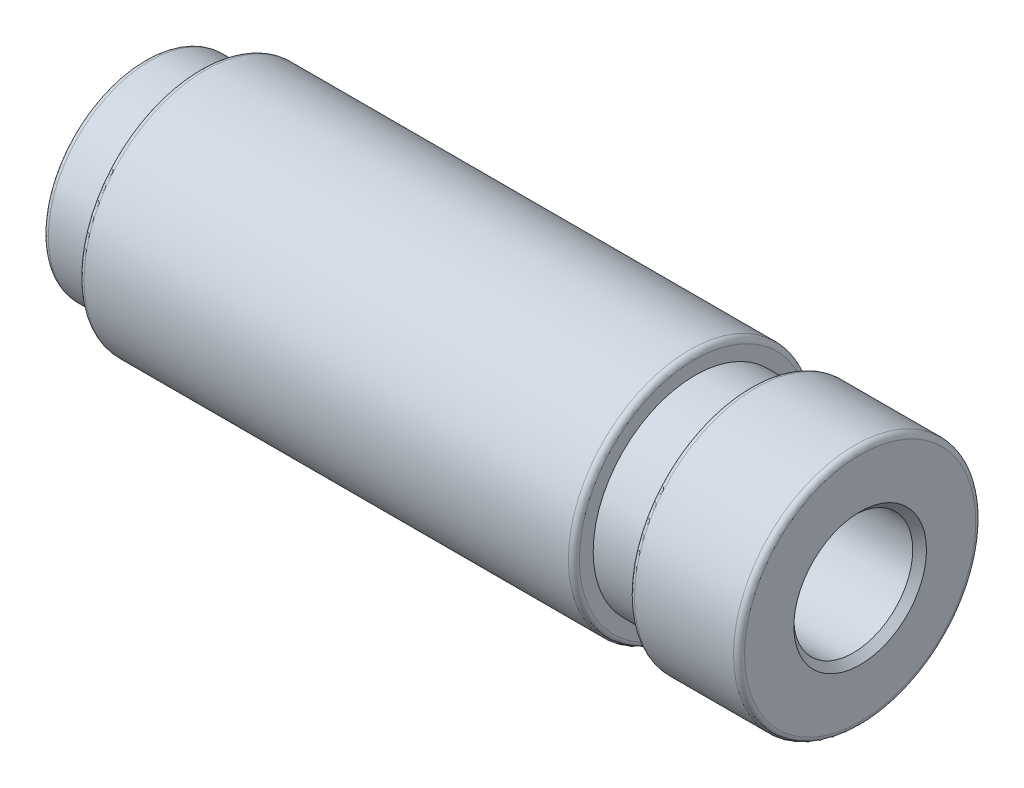
from build123d import *

# Parameters (mm, degrees)
ESBO_O2_R                             = 4.8
CORTE_EXTRUS_O1_DEPTH                 = 33
FURO_ROSCADO_DE_M12X1_251_D           = 10.8
FURO_ROSCADO_DE_M12X1_251_DEPTH       = 32
FURO_ROSCADO_DE_M12X1_251_CSINK_D     = 12.05
FURO_ROSCADO_DE_M12X1_251_CSINK_ANGLE = 90
FURO_ROSCADO_DE_M12X1_251_TIP         = 3.244647343
FILETE1_R                             = 1.5
FILETE2_R                             = 0.5
FILETE3_R                             = 0.5
FILETE4_R                             = 0.5


with BuildPart() as part:
    # Esboço1 → Revolução1 (revolve)
    with BuildSketch(Plane.XY, mode=Mode.PRIVATE) as revolu_o1_sk:
        Polygon((0, 0), (65, 0), (65, 11), (55, 11), (55, 9.25), (50, 9.25), (50, 11), (5, 11), (5, 9.25), (0, 9.25), align=None)
    revolve(revolu_o1_sk.sketch.rotate(Axis((0, 0, 0), (1, 0, 0)), 90), axis=Axis((0, 0, 0), (1, 0, 0)))

    # Esboço2 → Corte-extrusão1 (cut)
    with BuildSketch(Plane.ZY):
        Circle(ESBO_O2_R)
    extrude(amount=-CORTE_EXTRUS_O1_DEPTH, mode=Mode.SUBTRACT)

    # Furo roscado de M12x1.251
    with Locations(Plane(origin=(65, 0, 0), x_dir=(0, 0, -1), z_dir=(1, 0, 0))):
        with Locations((0, 0)):
            CounterSinkHole(FURO_ROSCADO_DE_M12X1_251_D / 2, FURO_ROSCADO_DE_M12X1_251_CSINK_D / 2, depth=FURO_ROSCADO_DE_M12X1_251_DEPTH, counter_sink_angle=FURO_ROSCADO_DE_M12X1_251_CSINK_ANGLE)
            with Locations((0, 0, -(FURO_ROSCADO_DE_M12X1_251_DEPTH + FURO_ROSCADO_DE_M12X1_251_TIP / 2))):  # 118° drill point
                Cone(0, FURO_ROSCADO_DE_M12X1_251_D / 2, FURO_ROSCADO_DE_M12X1_251_TIP, mode=Mode.SUBTRACT)

    # Filete1
    filete1_edges = [part.edges().sort_by_distance(p)[0] for p in [
        (0, 0, -4.8),
    ]]
    fillet(filete1_edges, radius=FILETE1_R)

    # Filete2
    filete2_edges = [part.edges().sort_by_distance(p)[0] for p in [
        (0, 0, -9.25),
    ]]
    fillet(filete2_edges, radius=FILETE2_R)

    # Filete3
    filete3_edges = [part.edges().sort_by_distance(p)[0] for p in [
        (65, 0, -11),
        (50, 0, -11),
        (55, 0, -11),
    ]]
    fillet(filete3_edges, radius=FILETE3_R)

    # Filete4
    filete4_edges = [part.edges().sort_by_distance(p)[0] for p in [
        (5, 0, -11),
    ]]
    fillet(filete4_edges, radius=FILETE4_R)


solid = part.part
